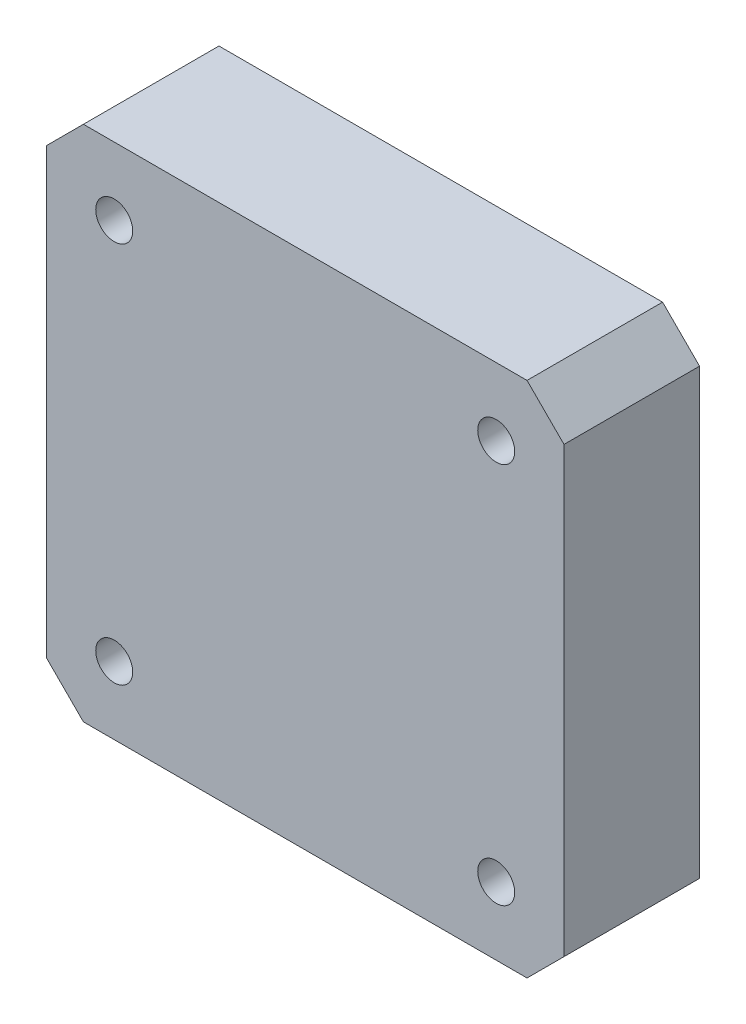
from build123d import *

# Parameters (mm, degrees)
SKETCH1_W           = 42
SKETCH1_H           = 42
BOSS_EXTRUDE1_DEPTH = 11
CHAMFER1_SIZE       = 3
SKETCH4_R           = 11.25
BOSS_EXTRUDE2_DEPTH = 0.5
CUT_EXTRUDE4_REACH  = 33.67
SKETCH8_R           = 1.5


with BuildPart() as part:
    # Sketch1 → Boss-Extrude1 (new body)
    with BuildSketch(Plane.XY):
        Rectangle(SKETCH1_W, SKETCH1_H)
    extrude(amount=BOSS_EXTRUDE1_DEPTH)

    # Chamfer1
    chamfer1_edges = [part.edges().sort_by_distance(p)[0] for p in [
        (-21, 21, 5.5),
        (21, 21, 5.5),
        (21, -21, 5.5),
        (-21, -21, 5.5),
    ]]
    chamfer(chamfer1_edges, length=CHAMFER1_SIZE)

    # Sketch4 → Boss-Extrude2 (add)
    with BuildSketch(Plane(origin=(0, 0, 0), x_dir=(-1, 0, 0), z_dir=(0, 0, -1))):
        Circle(SKETCH4_R)
    extrude(amount=-BOSS_EXTRUDE2_DEPTH)

    # Sketch8 → Cut-Extrude4 (cut, up to next)
    with BuildSketch(Plane(origin=(0, 0, 0), x_dir=(-1, 0, 0), z_dir=(0, 0, -1)), mode=Mode.PRIVATE) as cut_extrude4_sk1:
        with Locations((15.5, 15.5)):
            Circle(SKETCH8_R)
    cut_extrude4_tool1 = extrude(cut_extrude4_sk1.sketch, amount=-CUT_EXTRUDE4_REACH, mode=Mode.PRIVATE) & part.part
    # Sketch8 → Cut-Extrude4 (cut, up to next)
    with BuildSketch(Plane(origin=(0, 0, 0), x_dir=(-1, 0, 0), z_dir=(0, 0, -1)), mode=Mode.PRIVATE) as cut_extrude4_sk2:
        with Locations((-15.5, 15.5)):
            Circle(SKETCH8_R)
    cut_extrude4_tool2 = extrude(cut_extrude4_sk2.sketch, amount=-CUT_EXTRUDE4_REACH, mode=Mode.PRIVATE) & part.part
    # Sketch8 → Cut-Extrude4 (cut, up to next)
    with BuildSketch(Plane(origin=(0, 0, 0), x_dir=(-1, 0, 0), z_dir=(0, 0, -1)), mode=Mode.PRIVATE) as cut_extrude4_sk3:
        with Locations((-15.5, -15.5)):
            Circle(SKETCH8_R)
    cut_extrude4_tool3 = extrude(cut_extrude4_sk3.sketch, amount=-CUT_EXTRUDE4_REACH, mode=Mode.PRIVATE) & part.part
    # Sketch8 → Cut-Extrude4 (cut, up to next)
    with BuildSketch(Plane(origin=(0, 0, 0), x_dir=(-1, 0, 0), z_dir=(0, 0, -1)), mode=Mode.PRIVATE) as cut_extrude4_sk4:
        with Locations((15.5, -15.5)):
            Circle(SKETCH8_R)
    cut_extrude4_tool4 = extrude(cut_extrude4_sk4.sketch, amount=-CUT_EXTRUDE4_REACH, mode=Mode.PRIVATE) & part.part
    add(cut_extrude4_tool1.solids().sort_by_distance((-15.5, 15.5, 0))[0], mode=Mode.SUBTRACT)
    add(cut_extrude4_tool2.solids().sort_by_distance((15.5, 15.5, 0))[0], mode=Mode.SUBTRACT)
    add(cut_extrude4_tool3.solids().sort_by_distance((15.5, -15.5, 0))[0], mode=Mode.SUBTRACT)
    add(cut_extrude4_tool4.solids().sort_by_distance((-15.5, -15.5, 0))[0], mode=Mode.SUBTRACT)


solid = part.part
